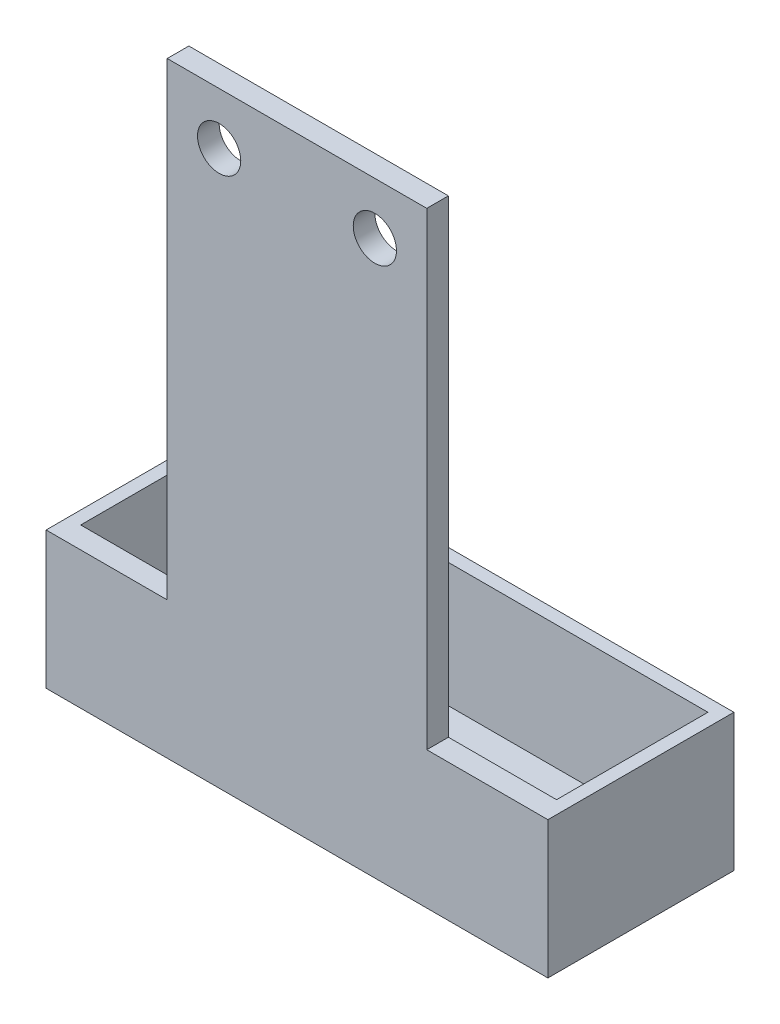
from build123d import *

# Parameters (mm, degrees)
EXTRUDE_1_DEPTH     = 5
EXTRUDE_2_DEPTH     = 35
SKETCH_4_W          = 116
SKETCH_4_H          = 31.7
EXTRUDE_3_DEPTH     = 3
SKETCH_6_R          = 5
CUT_EXTRUDE_1_DEPTH = 190.221017262


with BuildPart() as part:
    # 草图2 → 凸台-拉伸1 (new body)
    with BuildSketch(Plane.XY):
        Polygon((-30.006166306, -35.96646266), (29.993833694, -35.96646266), (29.993833694, -144.35646266), (57.993833694, -144.35646266), (57.993833694, -176.05646266), (-58.006166306, -176.05646266), (-58.006166306, -144.35646266), (-30.006166306, -144.35646266), align=None)
    extrude(amount=EXTRUDE_1_DEPTH)

    # 草图3 → 凸台-拉伸2 (add)
    with BuildSketch(Plane(origin=(0, 0, 0), x_dir=(-1, 0, 0), z_dir=(0, 0, -1))):
        Polygon((-57.993833694, -144.35646266), (-57.993833694, -176.05646266), (58.006166306, -176.05646266), (58.006166306, -144.35646266), (55.006166306, -144.35646266), (55.006166306, -173.05646266), (-54.993833694, -173.05646266), (-54.993833694, -144.35646266), align=None)
    extrude(amount=EXTRUDE_2_DEPTH)

    # 草图4 → 凸台-拉伸3 (add)
    with BuildSketch(Plane(origin=(0, 0, -35), x_dir=(-1, 0, 0), z_dir=(0, 0, -1))):
        with Locations((0.006166306, -160.20646266)):
            Rectangle(SKETCH_4_W, SKETCH_4_H)
    extrude(amount=EXTRUDE_3_DEPTH)

    # 草图6 → 切除-拉伸1 (cut, through all)
    with BuildSketch(Plane(origin=(0, 0, 0), x_dir=(-1, 0, 0), z_dir=(0, 0, -1))):
        with Locations((-17.993833694, -47.96646266)):
            Circle(SKETCH_6_R)
        with Locations(Location((18.006166306, -47.96646266, 0), (0, 0, 180))):
            Circle(SKETCH_6_R)
    extrude(amount=-CUT_EXTRUDE_1_DEPTH, mode=Mode.SUBTRACT)


solid = part.part
